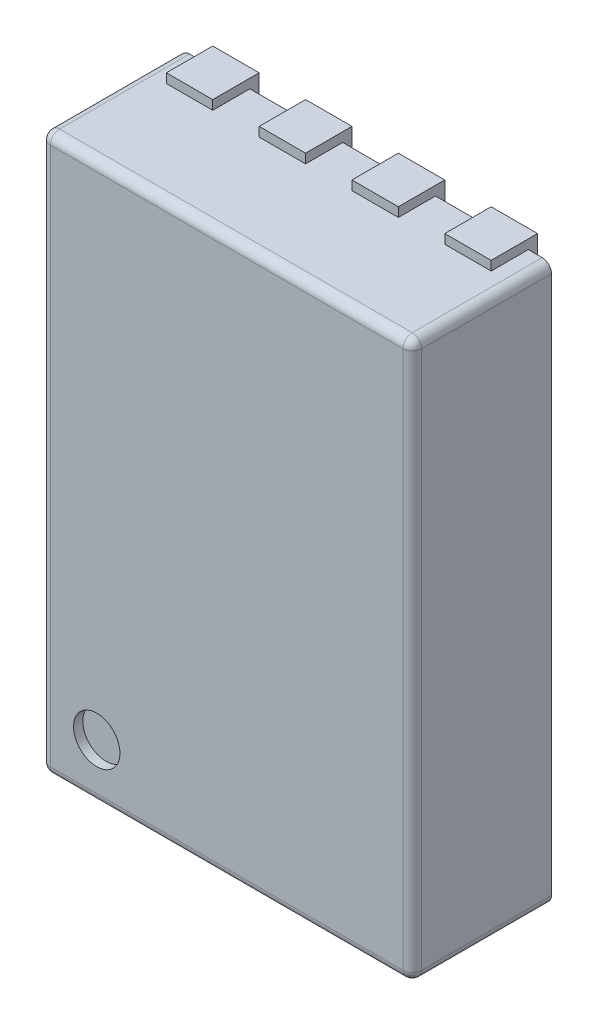
from build123d import *

# Parameters (mm, degrees)
SKETCH1_W            = 2
SKETCH1_H            = 3
EXTRUDE1_DEPTH       = 0.75
SKETCH2_R            = 0.125
EXTRUDE2_DEPTH       = 0.05
FILLET1_R            = 0.05
EXTRUDE_THIN1_DEPTH  = 0.125
SKETCH5_W            = 1.46
SKETCH5_H            = 1.36
EXTRUDE4_DEPTH       = 0.05
LPATTERN2_COUNT      = 4
LPATTERN2_PITCH      = 0.5
MIRROR1_COPY_1_DEPTH = 0.125
MIRROR1_COPY_2_DEPTH = 0.125
MIRROR1_COPY_3_DEPTH = 0.125


with BuildPart() as part:
    # Sketch1 → Extrude1 (new body)
    with BuildSketch(Plane.XY.offset(0.08)):
        Rectangle(SKETCH1_W, SKETCH1_H)
    extrude(amount=EXTRUDE1_DEPTH)

    # Sketch2 → Extrude2 (cut)
    with BuildSketch(Plane.XY.offset(0.83)):
        with Locations((-0.7, -1.2)):
            Circle(SKETCH2_R)
    extrude(amount=-EXTRUDE2_DEPTH, mode=Mode.SUBTRACT)

    # Fillet1
    fillet1_edges = [part.edges().sort_by_distance(p)[0] for p in [
        (1, 0, 0.83),
        (0, 1.5, 0.83),
        (-1, 0, 0.83),
        (0, -1.5, 0.83),
        (-1, 1.5, 0.455),
        (1, 1.5, 0.455),
        (1, -1.5, 0.455),
        (-1, -1.5, 0.455),
    ]]
    fillet(fillet1_edges, radius=FILLET1_R)


with BuildPart() as body_2:
    # Sketch4 → Extrude-Thin1 (new, symmetric)
    with BuildSketch(Plane(origin=(0.75, 0, 0), x_dir=(0, 0, -1), z_dir=(1, 0, 0))):
        Polygon((-0.28, -1.5), (-0.08, -1.5), (-0.08, -1.2), (-0.03, -1.2), (-0.03, -1.55), (-0.28, -1.55), align=None)
    extrude_thin1 = extrude(amount=EXTRUDE_THIN1_DEPTH, both=True)


with BuildPart() as body_3:
    # Sketch5 → Extrude4 (new body)
    with BuildSketch(Plane(origin=(0, 0, 0.08), x_dir=(-1, 0, 0), z_dir=(0, 0, -1))):
        Rectangle(SKETCH5_W, SKETCH5_H)
    extrude(amount=EXTRUDE4_DEPTH)


with BuildPart() as part_1:
    add(part.part)

    # LPattern2: Extrude-Thin1 ×4
    with Locations(*[(-i * LPATTERN2_PITCH, 0, 0) for i in range(1, LPATTERN2_COUNT)]):
        add(extrude_thin1)

    # Mirror1: Extrude-Thin1 across plane
    add(extrude_thin1.mirror(Plane.ZX))

    # Mirror1 copy 1 sketch → Mirror1 copy 1 (add, symmetric)
    with BuildSketch(Plane(origin=(0.25, 0, 0), x_dir=(0, 0, -1), z_dir=(1, 0, 0))):
        Polygon((-0.28, 1.5), (-0.08, 1.5), (-0.08, 1.2), (-0.03, 1.2), (-0.03, 1.55), (-0.28, 1.55), align=None)
    extrude(amount=MIRROR1_COPY_1_DEPTH, both=True)

    # Mirror1 copy 2 sketch → Mirror1 copy 2 (add, symmetric)
    with BuildSketch(Plane(origin=(-0.25, 0, 0), x_dir=(0, 0, -1), z_dir=(1, 0, 0))):
        Polygon((-0.28, 1.5), (-0.08, 1.5), (-0.08, 1.2), (-0.03, 1.2), (-0.03, 1.55), (-0.28, 1.55), align=None)
    extrude(amount=MIRROR1_COPY_2_DEPTH, both=True)

    # Mirror1 copy 3 sketch → Mirror1 copy 3 (add, symmetric)
    with BuildSketch(Plane(origin=(-0.75, 0, 0), x_dir=(0, 0, -1), z_dir=(1, 0, 0))):
        Polygon((-0.28, 1.5), (-0.08, 1.5), (-0.08, 1.2), (-0.03, 1.2), (-0.03, 1.55), (-0.28, 1.55), align=None)
    extrude(amount=MIRROR1_COPY_3_DEPTH, both=True)


solid = Compound([body_2.part, body_3.part, part_1.part])
